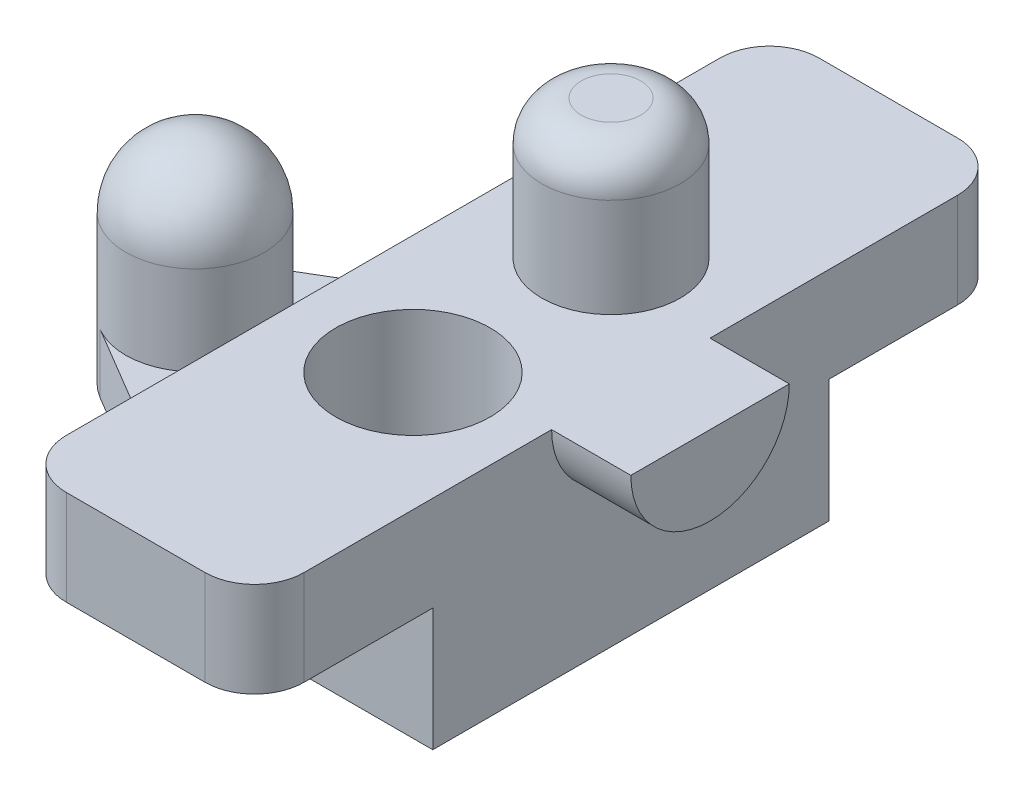
from build123d import *

# Parameters (mm, degrees)
BOSS_EXTRUDE1_DEPTH = 1.5
BOSS_EXTRUDE2_START = 4
SKETCH2_R           = 1.75
SKETCH2_W           = 6
SKETCH2_H           = 10
BOSS_EXTRUDE2_DEPTH = 4
BOSS_EXTRUDE3_DEPTH = 2.4
FILLET1_R           = 1.75
SKETCH4_R           = 1.75
BOSS_EXTRUDE4_DEPTH = 3.5
FILLET2_R           = 1
SKETCH5_R           = 1.95
CUT_EXTRUDE1_DEPTH  = 3.75
BOSS_EXTRUDE5_DEPTH = 2


with BuildPart() as part:
    # Sketch1 → Boss-Extrude1 (new body)
    with BuildSketch(Plane(origin=(0, 0, 0), x_dir=(1, 0, 0), z_dir=(0, 1, 0))):
        with BuildLine():
            Line((5, 5), (11, 5))
            Line((11, 5), (11, -5))
            Line((11, -5), (5, -5))
            Line((5, -5), (-0.892691591, -1.505191591))
            ThreePointArc((-0.892691591, -1.505191591), (-1.75, 0), (-0.892691591, 1.505191591))
            Line((-0.892691591, 1.505191591), (5, 5))
        make_face()
    extrude(amount=-BOSS_EXTRUDE1_DEPTH)

    # Sketch2 → Boss-Extrude2 (add)
    with BuildSketch(Plane(origin=(0, 0, 0), x_dir=(1, 0, 0), z_dir=(0, 1, 0)).offset(BOSS_EXTRUDE2_START)):
        with Locations(Location((0, 0, 0), (0, 0, 270))):
            Circle(SKETCH2_R)
        with Locations((8, 0)):
            Rectangle(SKETCH2_W, SKETCH2_H)
    extrude(amount=-BOSS_EXTRUDE2_DEPTH)

    # Sketch3 → Boss-Extrude3 (add)
    with BuildSketch(Plane(origin=(0, 4, 0), x_dir=(1, 0, 0), z_dir=(0, 1, 0))):
        with BuildLine():
            Line((5, 5), (11, 5))
            Line((11, 5), (11, 8.25))
            ThreePointArc((11, 8.25), (10.633883476, 9.133883476), (9.75, 9.5))
            Line((9.75, 9.5), (6.25, 9.5))
            ThreePointArc((6.25, 9.5), (5.366116524, 9.133883476), (5, 8.25))
            Line((5, 8.25), (5, 5))
        make_face()
        with BuildLine():
            Line((5, -5), (11, -5))
            Line((11, -5), (11, -8.25))
            ThreePointArc((11, -8.25), (10.633883476, -9.133883476), (9.75, -9.5))
            Line((9.75, -9.5), (6.25, -9.5))
            ThreePointArc((6.25, -9.5), (5.366116524, -9.133883476), (5, -8.25))
            Line((5, -8.25), (5, -5))
        make_face()
    extrude(amount=-BOSS_EXTRUDE3_DEPTH)

    # Fillet1
    fillet1_edges = [part.edges().sort_by_distance(p)[0] for p in [
        (0, 4, -1.75),
    ]]
    fillet(fillet1_edges, radius=FILLET1_R)

    # Sketch4 → Boss-Extrude4 (add)
    with BuildSketch(Plane(origin=(0, 4, 0), x_dir=(1, 0, 0), z_dir=(0, 1, 0))):
        with Locations(Location((8, 2.5, 0), (0, 0, 270))):
            Circle(SKETCH4_R)
    extrude(amount=BOSS_EXTRUDE4_DEPTH)

    # Fillet2
    fillet2_edges = [part.edges().sort_by_distance(p)[0] for p in [
        (8, 7.5, -4.25),
    ]]
    fillet(fillet2_edges, radius=FILLET2_R)

    # Sketch5 → Cut-Extrude1 (cut)
    with BuildSketch(Plane(origin=(0, 4, 0), x_dir=(1, 0, 0), z_dir=(0, 1, 0))):
        with Locations(Location((8, -2.5, 0), (0, 0, 270))):
            Circle(SKETCH5_R)
    extrude(amount=-CUT_EXTRUDE1_DEPTH, mode=Mode.SUBTRACT)

    # Sketch6 → Boss-Extrude5 (add)
    with BuildSketch(Plane(origin=(11, 0, 0), x_dir=(0, 0, -1), z_dir=(1, 0, 0))):
        with BuildLine():
            Line((-2, 4), (2, 4))
            ThreePointArc((2, 4), (0, 2), (-2, 4))
        make_face()
    extrude(amount=BOSS_EXTRUDE5_DEPTH)


solid = part.part
